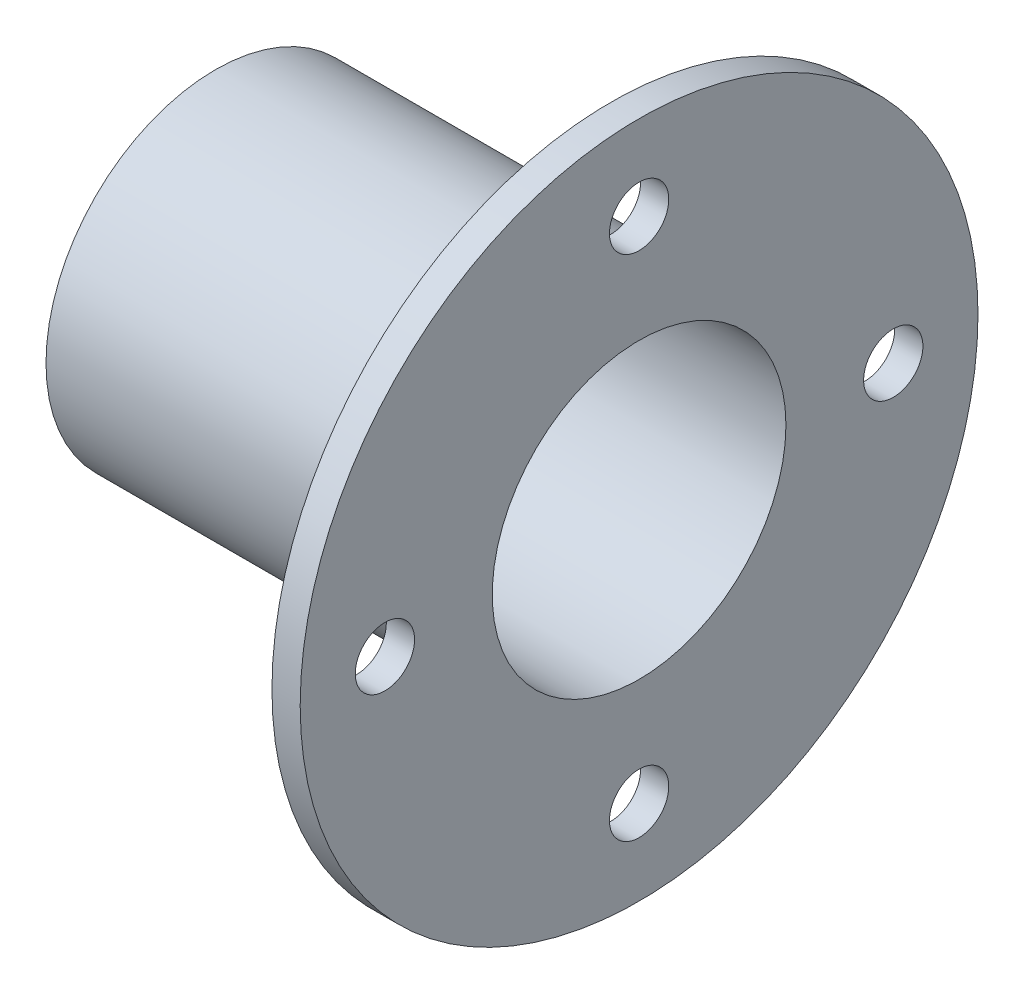
from build123d import *

# Parameters (mm, degrees)
SZKIC1_R                    = 30
SZKIC1_R_2                  = 26
DODANIE_WYCI_GNI_CIE1_DEPTH = 70
SZKIC2_R                    = 60
SZKIC2_R_2                  = 26
DODANIE_WYCI_GNI_CIE2_DEPTH = 5
SZKIC3_R                    = 5.25
WYTNIJ_WYCI_GNI_CIE1_DEPTH  = 5


with BuildPart() as part:
    # Szkic1 → Dodanie-wyciągnięcie1 (new body)
    with BuildSketch(Plane(origin=(0, 0, 0), x_dir=(0, 0, -1), z_dir=(1, 0, 0))):
        Circle(SZKIC1_R)
        Circle(SZKIC1_R_2, mode=Mode.SUBTRACT)
    extrude(amount=DODANIE_WYCI_GNI_CIE1_DEPTH)

    # Szkic2 → Dodanie-wyciągnięcie2 (add)
    with BuildSketch(Plane(origin=(70, 0, 0), x_dir=(0, 0, -1), z_dir=(1, 0, 0))):
        Circle(SZKIC2_R)
        Circle(SZKIC2_R_2, mode=Mode.SUBTRACT)
    extrude(amount=DODANIE_WYCI_GNI_CIE2_DEPTH)

    # Szkic3 → Wytnij-wyciągnięcie1 (cut)
    with BuildSketch(Plane(origin=(75, 0, 0), x_dir=(0, 0, -1), z_dir=(1, 0, 0))):
        with Locations((-45, 0)):
            Circle(SZKIC3_R)
        with Locations((45, 0)):
            Circle(SZKIC3_R)
        with Locations((0, -45)):
            Circle(SZKIC3_R)
        with Locations((0, 45)):
            Circle(SZKIC3_R)
    extrude(amount=-WYTNIJ_WYCI_GNI_CIE1_DEPTH, mode=Mode.SUBTRACT)


solid = part.part
